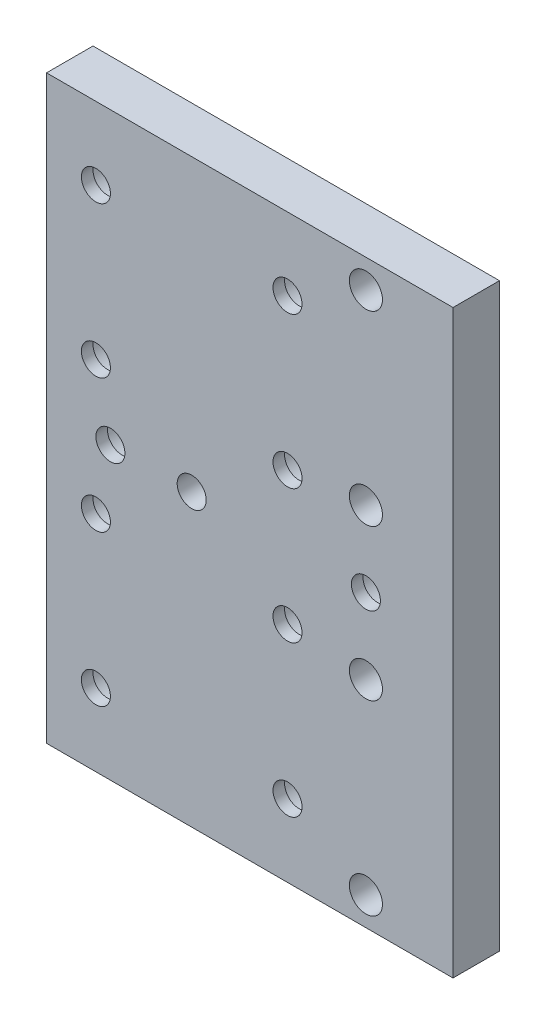
from build123d import *

# Parameters (mm, degrees)
SKETCH1_W           = 70
SKETCH1_H           = 120
SKETCH1_R           = 2.5
SKETCH1_R_2         = 2.85
BOSS_EXTRUDE1_DEPTH = 8
SKETCH2_R           = 2.5
CUT_EXTRUDE1_DEPTH  = 93.54188241
SKETCH4_W           = 106.143175547
SKETCH4_H           = 17.825571466
SKETCH4_W_2         = 120.889784669
SKETCH4_H_2         = 15.71891302
CUT_EXTRUDE2_DEPTH  = 93.54188241
SKETCH5_R           = 2.5
CUT_EXTRUDE3_DEPTH  = 87.394444266
SKETCH6_R           = 4.25
CUT_EXTRUDE4_DEPTH  = 6
SKETCH7_R           = 4.25
CUT_EXTRUDE5_DEPTH  = 6


with BuildPart() as part:
    # Sketch1 → Boss-Extrude1 (new body)
    with BuildSketch(Plane.XY):
        with Locations((-35, 0)):
            Rectangle(SKETCH1_W, SKETCH1_H)
        with Locations((-61.5, 37.5)):
            Circle(SKETCH1_R, mode=Mode.SUBTRACT)
        with Locations((-28.5, 37.5)):
            Circle(SKETCH1_R, mode=Mode.SUBTRACT)
        with Locations((-61.5, 11.5)):
            Circle(SKETCH1_R, mode=Mode.SUBTRACT)
        with Locations((-28.5, 11.5)):
            Circle(SKETCH1_R, mode=Mode.SUBTRACT)
        with Locations((-61.5, -11.5)):
            Circle(SKETCH1_R, mode=Mode.SUBTRACT)
        with Locations((-28.5, -11.5)):
            Circle(SKETCH1_R, mode=Mode.SUBTRACT)
        with Locations((-28.5, -37.5)):
            Circle(SKETCH1_R, mode=Mode.SUBTRACT)
        with Locations((-61.5, -37.5)):
            Circle(SKETCH1_R, mode=Mode.SUBTRACT)
        with Locations((-15, 45.1)):
            Circle(SKETCH1_R_2, mode=Mode.SUBTRACT)
        with Locations((-15, 13)):
            Circle(SKETCH1_R_2, mode=Mode.SUBTRACT)
        with Locations((-15, -13)):
            Circle(SKETCH1_R_2, mode=Mode.SUBTRACT)
        with Locations((-15, -45.1)):
            Circle(SKETCH1_R_2, mode=Mode.SUBTRACT)
    extrude(amount=BOSS_EXTRUDE1_DEPTH)

    # Sketch2 → Cut-Extrude1 (cut, through all)
    with BuildSketch(Plane.XY.offset(8)):
        with Locations((-45, 0)):
            Circle(SKETCH2_R)
    extrude(amount=-CUT_EXTRUDE1_DEPTH, mode=Mode.SUBTRACT)

    # Sketch4 → Cut-Extrude2 (cut, through all)
    with BuildSketch(Plane(origin=(0, 0, 0), x_dir=(-1, 0, 0), z_dir=(0, 0, -1))):
        with Locations((33.542634591, 58.912785733)):
            Rectangle(SKETCH4_W, SKETCH4_H)
        with Locations((34.920065114, -57.85945651)):
            Rectangle(SKETCH4_W_2, SKETCH4_H_2)
    extrude(amount=-CUT_EXTRUDE2_DEPTH, mode=Mode.SUBTRACT)

    # Sketch5 → Cut-Extrude3 (cut, through all)
    with BuildSketch(Plane(origin=(0, 0, 0), x_dir=(-1, 0, 0), z_dir=(0, 0, -1))):
        with Locations((59, 0)):
            Circle(SKETCH5_R)
        with Locations((15, 0)):
            Circle(SKETCH5_R)
    extrude(amount=-CUT_EXTRUDE3_DEPTH, mode=Mode.SUBTRACT)

    # Sketch6 → Cut-Extrude4 (cut)
    with BuildSketch(Plane(origin=(0, 0, 0), x_dir=(-1, 0, 0), z_dir=(0, 0, -1))):
        with Locations((28.5, 37.5)):
            Circle(SKETCH6_R)
        with Locations((61.5, 37.5)):
            Circle(SKETCH6_R)
        with Locations((28.5, 11.5)):
            Circle(SKETCH6_R)
        with Locations((61.5, 11.5)):
            Circle(SKETCH6_R)
        with Locations((28.5, -11.5)):
            Circle(SKETCH6_R)
        with Locations((61.5, -11.5)):
            Circle(SKETCH6_R)
        with Locations((61.5, -37.5)):
            Circle(SKETCH6_R)
        with Locations((28.5, -37.5)):
            Circle(SKETCH6_R)
    extrude(amount=-CUT_EXTRUDE4_DEPTH, mode=Mode.SUBTRACT)

    # Sketch7 → Cut-Extrude5 (cut)
    with BuildSketch(Plane(origin=(0, 0, 0), x_dir=(-1, 0, 0), z_dir=(0, 0, -1))):
        with Locations((15, 0)):
            Circle(SKETCH7_R)
        with Locations((59, 0)):
            Circle(SKETCH7_R)
    extrude(amount=-CUT_EXTRUDE5_DEPTH, mode=Mode.SUBTRACT)


solid = part.part
